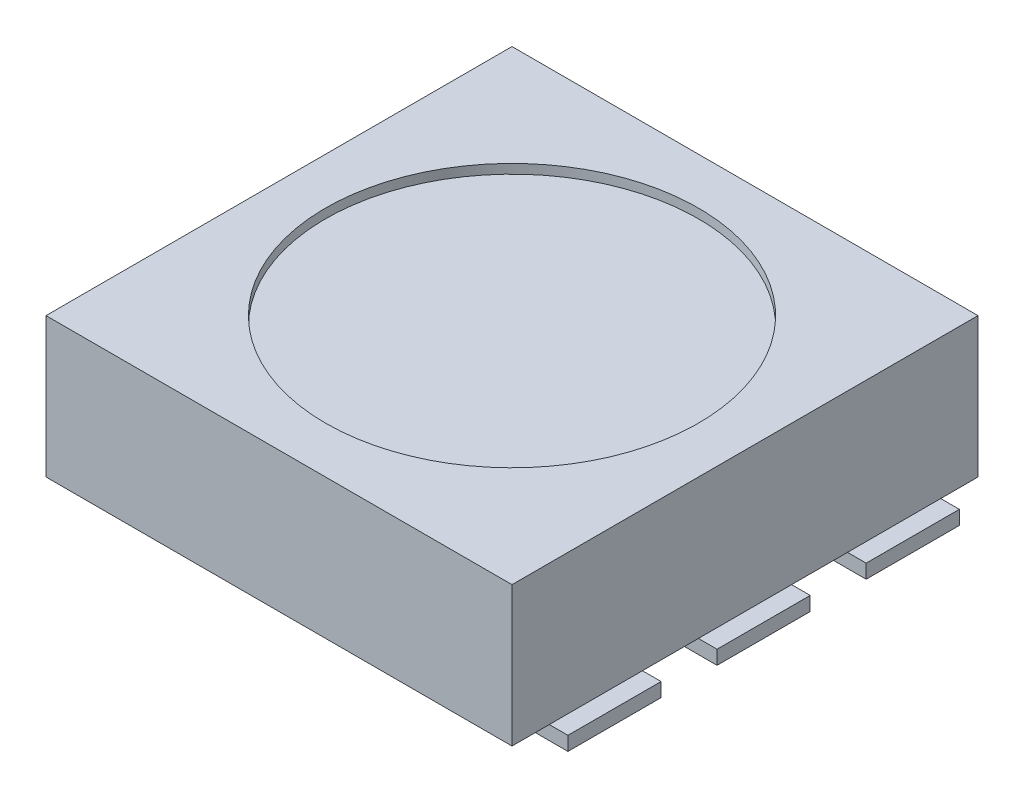
from build123d import *

# Parameters (mm, degrees)
SKETCH1_W           = 5
SKETCH1_H           = 5
BOSS_EXTRUDE1_DEPTH = 1.5
SKETCH1_3_W         = 1
SKETCH1_3_H         = 1
BOSS_EXTRUDE2_DEPTH = 0.15
SKETCH2_R           = 2
CUT_EXTRUDE1_DEPTH  = 0.1


with BuildPart() as part:
    # Sketch1 → Boss-Extrude1 (new body)
    with BuildSketch(Plane(origin=(0, 0, 0), x_dir=(1, 0, 0), z_dir=(0, 1, 0))):
        Rectangle(SKETCH1_W, SKETCH1_H)
    extrude(amount=BOSS_EXTRUDE1_DEPTH)

    # Sketch1<3> → Boss-Extrude2 (add)
    with BuildSketch(Plane(origin=(0, 0, 0), x_dir=(1, 0, 0), z_dir=(0, 1, 0))):
        with Locations((2.2, -1.6)):
            Rectangle(SKETCH1_3_W, SKETCH1_3_H)
        with Locations((-2.2, -1.6)):
            Rectangle(SKETCH1_3_W, SKETCH1_3_H)
        with Locations((2.2, 0)):
            Rectangle(SKETCH1_3_W, SKETCH1_3_H)
        with Locations((2.2, 1.6)):
            Rectangle(SKETCH1_3_W, SKETCH1_3_H)
        with Locations((-2.2, 0)):
            Rectangle(SKETCH1_3_W, SKETCH1_3_H)
        with Locations((-2.2, 1.6)):
            Rectangle(SKETCH1_3_W, SKETCH1_3_H)
    extrude(amount=-BOSS_EXTRUDE2_DEPTH)

    # Sketch2 → Cut-Extrude1 (cut)
    with BuildSketch(Plane(origin=(0, 1.5, 0), x_dir=(1, 0, 0), z_dir=(0, 1, 0))):
        Circle(SKETCH2_R)
    extrude(amount=-CUT_EXTRUDE1_DEPTH, mode=Mode.SUBTRACT)


solid = part.part
